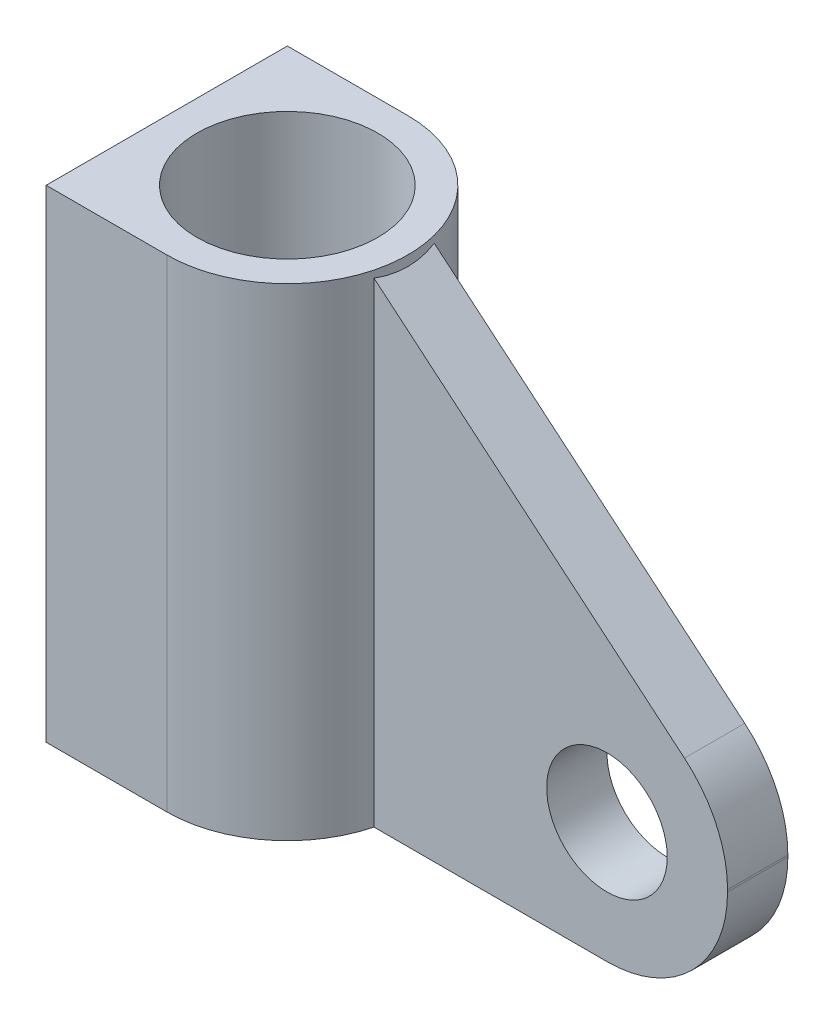
from build123d import *

# Parameters (mm, degrees)
SKETCH1_R                = 6.35
SKETCH1_R_2              = 4.7625
BOSS_EXTRUDE1_DEPTH      = 12.7
BOSS_EXTRUDE2_DEPTH      = 1.5875
SKETCH3_R                = 3.175
CUT_EXTRUDE1_DEPTH       = 29.941304933
BOSS_EXTRUDE3_REACH      = 36.202
BOSS_EXTRUDE3_END_RADIUS = 6.35
SKETCH4_W                = 12.7
SKETCH4_H                = 25.4


with BuildPart() as part:
    # Sketch1 → Boss-Extrude1 (new, symmetric)
    with BuildSketch(Plane(origin=(0, 0, 0), x_dir=(1, 0, 0), z_dir=(0, 1, 0))):
        with Locations(Location((0, 0, 0), (0, 0, 270))):
            Circle(SKETCH1_R)
        with Locations(Location((0, 0, 0), (0, 0, 270))):
            Circle(SKETCH1_R_2, mode=Mode.SUBTRACT)
    extrude(amount=BOSS_EXTRUDE1_DEPTH, both=True)

    # Sketch2 → Boss-Extrude2 (add, symmetric)
    with BuildSketch(Plane.XY):
        with BuildLine():
            Line((5.715, -12.7), (18.415, -12.7))
            ThreePointArc((18.415, -12.7), (22.905128061, -10.840128061), (24.765, -6.35))
            Line((24.765, -6.35), (24.765, -6.245901603))
            ThreePointArc((24.765, -6.245901603), (24.170054448, -3.562275641), (22.496701322, -1.381519389))
            Line((22.496701322, -1.381519389), (5.715, 12.7))
            Line((5.715, 12.7), (5.715, -12.7))
        make_face()
    extrude(amount=BOSS_EXTRUDE2_DEPTH, both=True)

    # Sketch3 → Cut-Extrude1 (cut, through all)
    with BuildSketch(Plane.XY.offset(1.5875)):
        with Locations((18.415, -6.35)):
            Circle(SKETCH3_R)
    extrude(amount=-CUT_EXTRUDE1_DEPTH, mode=Mode.SUBTRACT)

    # Boss-Extrude3: up to this cylinder (the profile starts outside it)
    boss_extrude3_end = Plane(origin=(0, 0, 0), z_dir=(0, -1, 0)) * Cylinder(BOSS_EXTRUDE3_END_RADIUS, 86.104, mode=Mode.PRIVATE)
    # Sketch4 → Boss-Extrude3 (add, up to the surface)
    with BuildSketch(Plane.ZY.offset(6.35), mode=Mode.PRIVATE) as boss_extrude3_sk1:
        Rectangle(SKETCH4_W, SKETCH4_H)
    boss_extrude3_tool1 = extrude(boss_extrude3_sk1.sketch, amount=-BOSS_EXTRUDE3_REACH, mode=Mode.PRIVATE) - boss_extrude3_end
    add(boss_extrude3_tool1.solids().sort_by_distance((-6.35, 0, 0))[0])
    add(boss_extrude3_tool1.solids().sort_by_distance((-6.35, 0, 0))[1])


solid = part.part
